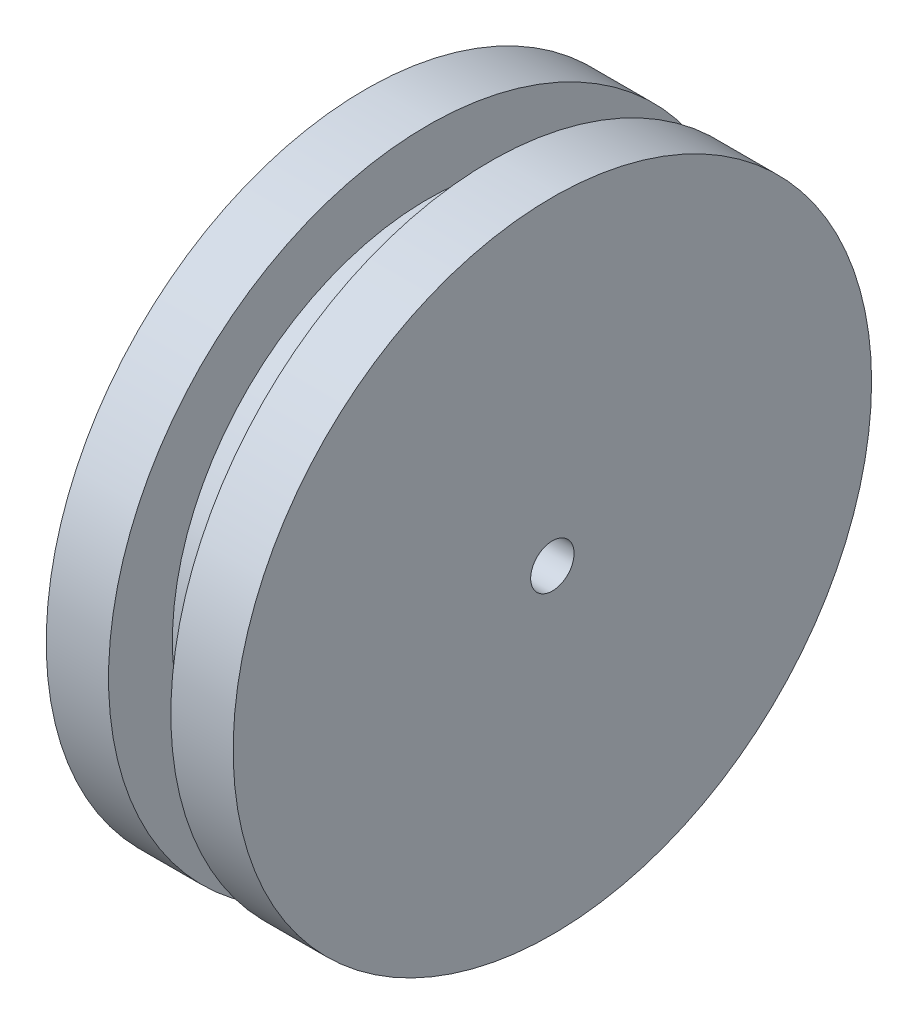
from build123d import *

# Parameters (mm, degrees)
SKETCH3_R           = 15.875
BOSS_EXTRUDE1_DEPTH = 3.0988
SKETCH5_R           = 12.7
BOSS_EXTRUDE2_DEPTH = 3.0988
SKETCH6_R           = 15.875
BOSS_EXTRUDE3_DEPTH = 3.0988
SKETCH7_R           = 1.0795
CUT_EXTRUDE1_DEPTH  = 25.299265482


with BuildPart() as part:
    # Sketch3 → Boss-Extrude1 (new body)
    with BuildSketch(Plane(origin=(0, 0, 0), x_dir=(0, 0, -1), z_dir=(1, 0, 0))):
        Circle(SKETCH3_R)
    extrude(amount=BOSS_EXTRUDE1_DEPTH)


with BuildPart() as body_2:
    # Sketch5 → Boss-Extrude2 (new body)
    with BuildSketch(Plane(origin=(3.0988, 0, 0), x_dir=(0, 0, -1), z_dir=(1, 0, 0))):
        Circle(SKETCH5_R)
    extrude(amount=BOSS_EXTRUDE2_DEPTH)


with BuildPart() as body_3:
    # Sketch6 → Boss-Extrude3 (new body)
    with BuildSketch(Plane(origin=(6.1976, 0, 0), x_dir=(0, 0, -1), z_dir=(1, 0, 0))):
        Circle(SKETCH6_R)
    extrude(amount=BOSS_EXTRUDE3_DEPTH)


with BuildPart() as cut_extrude1_tool:
    # Sketch7 → Cut-Extrude1 (new, through all)
    with BuildSketch(Plane(origin=(9.2964, 0, 0), x_dir=(0, 0, -1), z_dir=(1, 0, 0))):
        Circle(SKETCH7_R)
    extrude(amount=-CUT_EXTRUDE1_DEPTH)


with BuildPart() as part_1:
    add(part.part)

    # Cut-Extrude1: cut by cut_extrude1_tool
    add(cut_extrude1_tool.part, mode=Mode.SUBTRACT)


with BuildPart() as body_2_1:
    add(body_2.part)

    # Cut-Extrude1: cut by cut_extrude1_tool
    add(cut_extrude1_tool.part, mode=Mode.SUBTRACT)


with BuildPart() as body_3_1:
    add(body_3.part)

    # Cut-Extrude1: cut by cut_extrude1_tool
    add(cut_extrude1_tool.part, mode=Mode.SUBTRACT)


solid = Compound([part_1.part, body_2_1.part, body_3_1.part])
